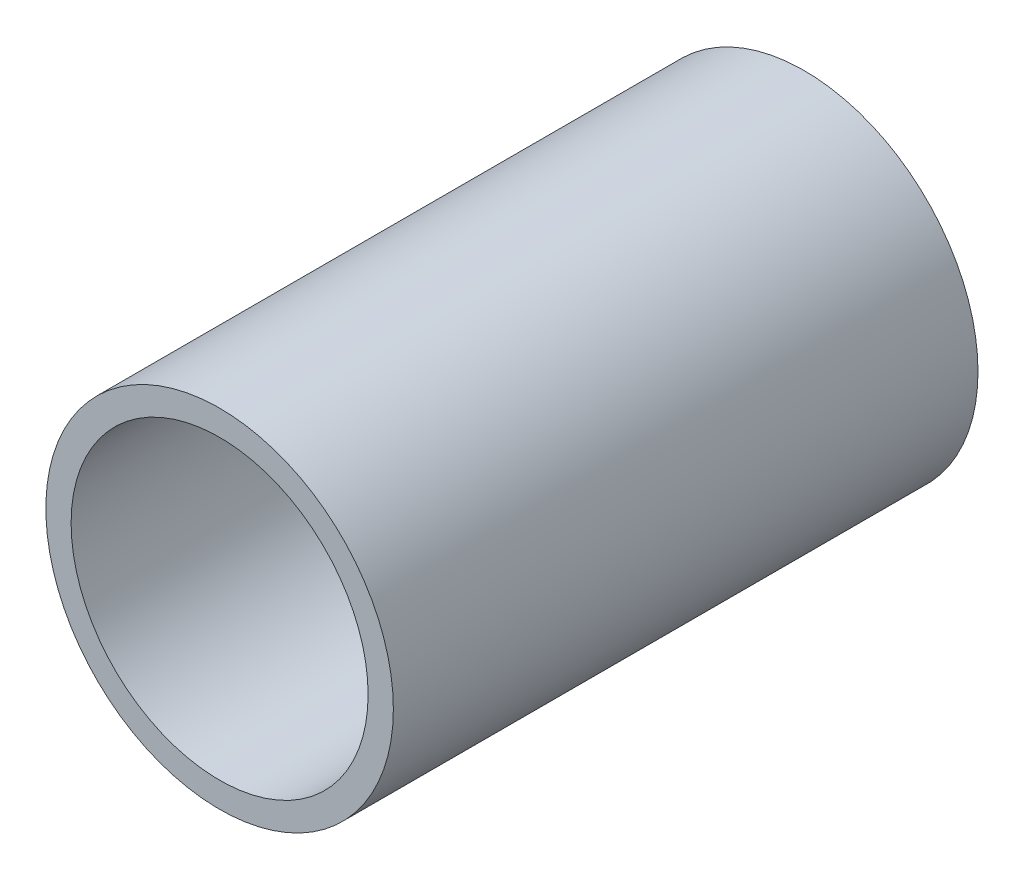
from build123d import *

# Parameters (mm, degrees)
CROQUIS1_R              = 29.72
CROQUIS1_R_2            = 25.4
SALIENTE_EXTRUIR1_DEPTH = 100


with BuildPart() as part:
    # Croquis1 → Saliente-Extruir1 (new body)
    with BuildSketch(Plane.XY):
        Circle(CROQUIS1_R)
        Circle(CROQUIS1_R_2, mode=Mode.SUBTRACT)
    extrude(amount=SALIENTE_EXTRUIR1_DEPTH)


solid = part.part
